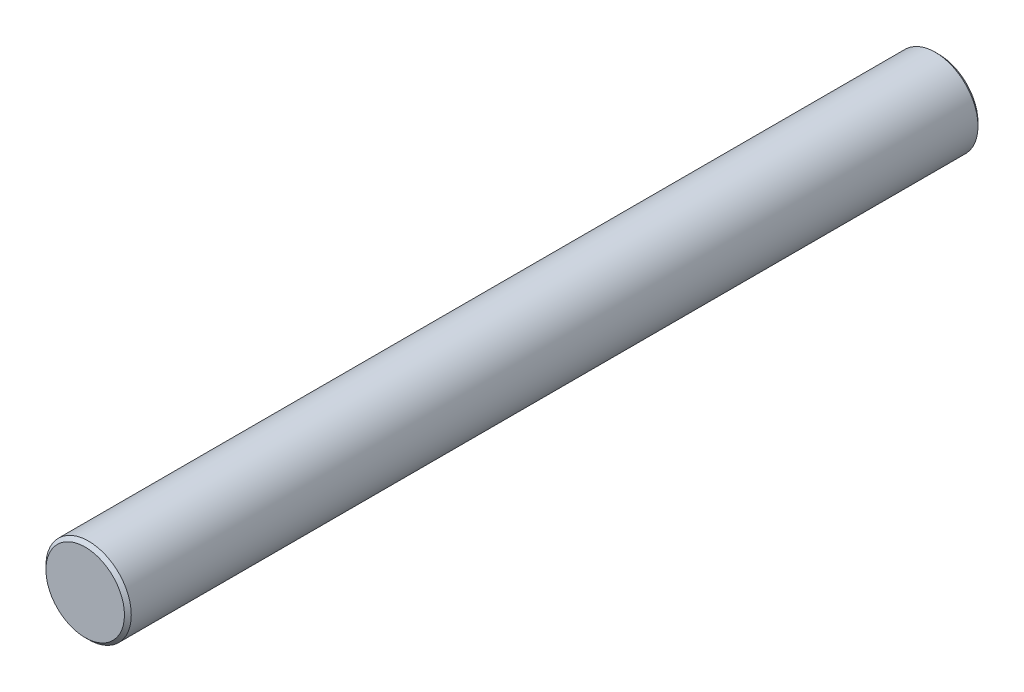
from build123d import *

# Parameters (mm, degrees)
SKIZZE1_R                       = 5
AUFSATZ_LINEAR_AUSTRAGEN1_DEPTH = 100
FASE1_SIZE                      = 0.4


with BuildPart() as part:
    # Skizze1 → Aufsatz-Linear austragen1 (new body)
    with BuildSketch(Plane.XY):
        Circle(SKIZZE1_R)
    extrude(amount=AUFSATZ_LINEAR_AUSTRAGEN1_DEPTH)

    # Fase1
    fase1_edges = [part.edges().sort_by_distance(p)[0] for p in [
        (-5, 0, 0),
        (-5, 0, 100),
    ]]
    chamfer(fase1_edges, length=FASE1_SIZE)


solid = part.part
